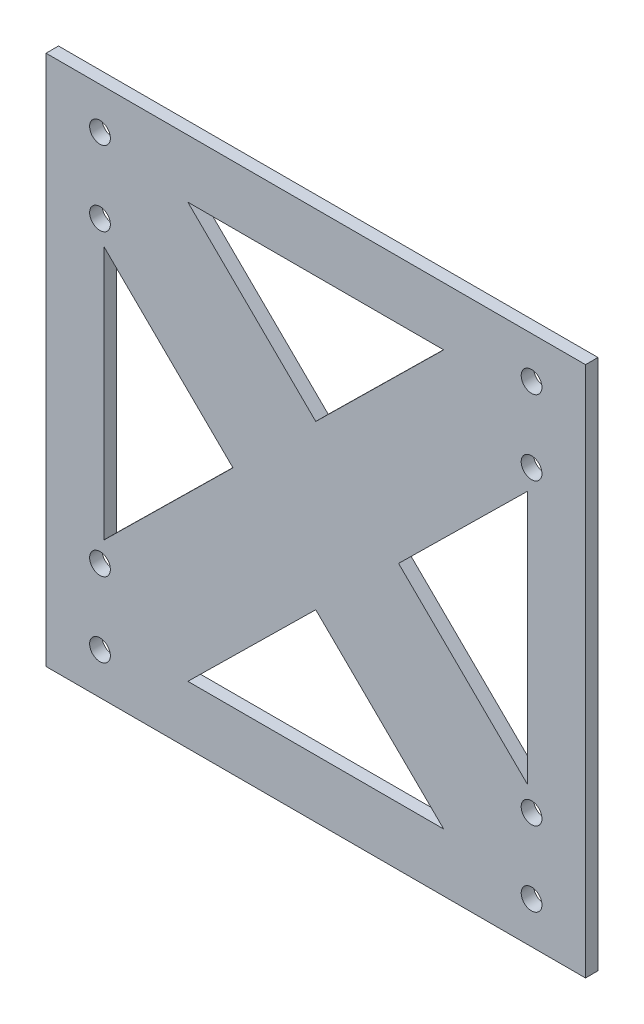
from build123d import *

# Parameters (mm, degrees)
SKETCH_2_W          = 130
SKETCH_2_H          = 128
EXTRUDE_1_DEPTH     = 3
SKETCH_3_R          = 2.5
CUT_EXTRUDE_1_DEPTH = 92.268833673


with BuildPart() as part:
    # 草圖2 → 填料-伸長1 (new body)
    with BuildSketch(Plane.XY):
        Rectangle(SKETCH_2_W, SKETCH_2_H)
        Polygon((0, 19.647280252), (30.826980994, 50), (-30.826980994, 50), align=None, mode=Mode.SUBTRACT)
        Polygon((-51, 30.568104363), (-19.954269006, 0), (-51, -30.568104363), align=None, mode=Mode.SUBTRACT)
        Polygon((19.954269006, 0), (51, 30.568104363), (51, -30.568104363), align=None, mode=Mode.SUBTRACT)
        Polygon((30.826980994, -50), (0, -19.647280252), (-30.826980994, -50), align=None, mode=Mode.SUBTRACT)
    extrude(amount=EXTRUDE_1_DEPTH)

    # 草圖3 → 除料-伸長1 (cut, through all)
    with BuildSketch(Plane(origin=(0, 0, 0), x_dir=(-1, 0, 0), z_dir=(0, 0, -1))):
        with Locations((-52, -54)):
            Circle(SKETCH_3_R)
        with Locations((-52, -36)):
            Circle(SKETCH_3_R)
        with Locations((52, -54)):
            Circle(SKETCH_3_R)
        with Locations((52, -36)):
            Circle(SKETCH_3_R)
        with Locations((-52, 54)):
            Circle(SKETCH_3_R)
        with Locations((-52, 36)):
            Circle(SKETCH_3_R)
        with Locations((52, 54)):
            Circle(SKETCH_3_R)
        with Locations((52, 36)):
            Circle(SKETCH_3_R)
    extrude(amount=-CUT_EXTRUDE_1_DEPTH, mode=Mode.SUBTRACT)


solid = part.part
